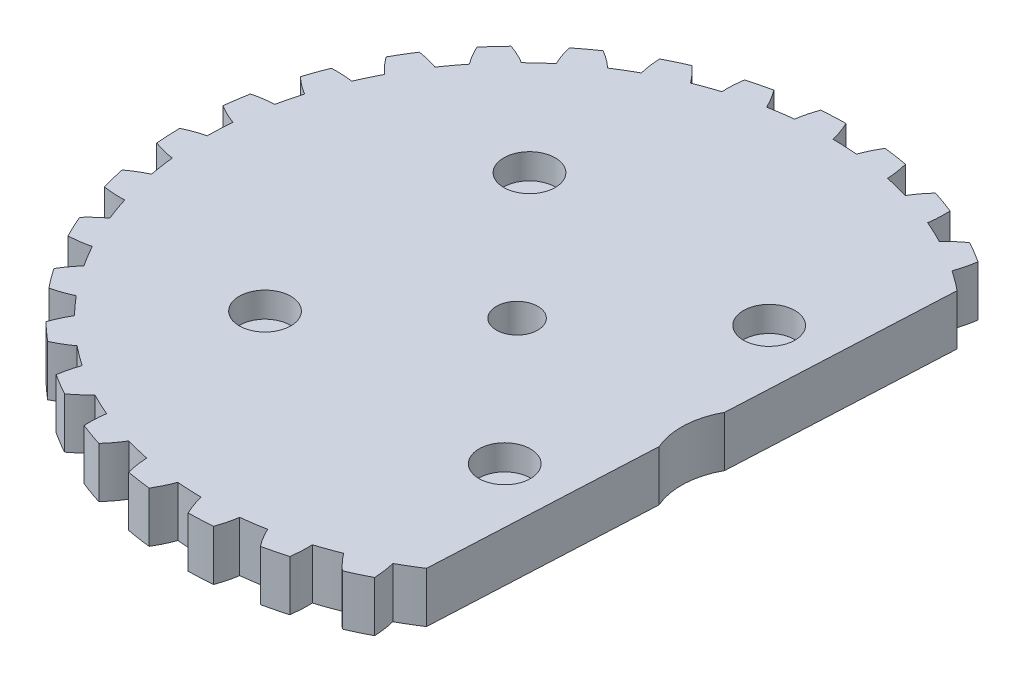
from build123d import *

# Parameters (mm, degrees)
SKETCH_5_R               = 62
EXTRUDE_5_DEPTH          = 10
EXTRUDE_6_DEPTH          = 10
PATTERN_CIRCULAR_3_COUNT = 32
SKETCH_6_R               = 5.1
CUT_EXTRUDE_1_DEPTH      = 5
SKETCH_7_R               = 4.1
CUT_EXTRUDE_2_DEPTH      = 94.864898271


with BuildPart() as part:
    # ｽｹｯﾁ5 → ﾎﾞｽ - 押し出し5 (new body)
    with BuildSketch(Plane(origin=(0, 0, 0), x_dir=(1, 0, 0), z_dir=(0, 1, 0))):
        with Locations(Location((0, 0, 0), (0, 0, 270))):
            Circle(SKETCH_5_R)
    extrude(amount=EXTRUDE_5_DEPTH)

    # ｽｹｯﾁ3 → ﾎﾞｽ - 押し出し6 (add)
    with BuildSketch(Plane(origin=(0, 0, 0), x_dir=(1, 0, 0), z_dir=(0, 1, 0))):
        with BuildLine():
            ThreePointArc((0.610421318, 61.996994974), (-3.042195808, 61.925318285), (-6.684250129, 61.638630746))
            add(Edge.make_bspline(
                [(-5.641686214, 65.758431981), (-5.705166523, 65.578395477), (-5.812149918, 65.264477653), (-5.954225381, 64.819801901), (-6.071216349, 64.43148887), (-6.177205967, 64.057284262), (-6.272697001, 63.69744192), (-6.358197404, 63.352203098), (-6.434220795, 63.02179612), (-6.501283354, 62.706436), (-6.559913319, 62.40632559), (-6.622924018, 62.052553392), (-6.662333587, 61.798155334), (-6.684250129, 61.638630746)],
                knots=[0, 0, 0, 0, 0.134543628, 0.233721196, 0.328992487, 0.420357503, 0.507816242, 0.591368706, 0.671014894, 0.746754806, 0.818588443, 0.886515803, 1, 1, 1, 1], degree=3))
            ThreePointArc((-5.641686214, 65.758431981), (-3.238466506, 65.92050011), (-0.830933502, 65.994769107))
            add(Edge.make_bspline(
                [(-0.830933502, 65.994769107), (-0.750112205, 65.821821686), (-0.612874637, 65.519901669), (-0.42789746, 65.091292982), (-0.273408504, 64.716316905), (-0.131250789, 64.354302994), (-0.000948853, 64.005553149), (0.117979164, 63.670357251), (0.226022029, 63.348992869), (0.323672361, 63.041724574), (0.411435971, 62.74880602), (0.508818995, 62.40291346), (0.572974167, 62.153603211), (0.610421318, 61.996994974)],
                knots=[0, 0, 0, 0, 0.134543628, 0.233721196, 0.328992487, 0.420357503, 0.507816242, 0.591368706, 0.671014894, 0.746754806, 0.818588443, 0.886515803, 1, 1, 1, 1], degree=3))
        make_face()
    extrude_6 = extrude(amount=EXTRUDE_6_DEPTH)

    # 円形ﾊﾟﾀｰﾝ3: ﾎﾞｽ - 押し出し6 ×32 about axis
    pattern_circular_3_axis = Axis((0, 10, 0), (0, 1, 0))
    for i in range(1, PATTERN_CIRCULAR_3_COUNT):
        add(extrude_6.rotate(pattern_circular_3_axis, i * 360 / PATTERN_CIRCULAR_3_COUNT))

    # ｽｹｯﾁ6 → ｶｯﾄ - 押し出し1 (cut)
    with BuildSketch(Plane(origin=(0, 10, 0), x_dir=(1, 0, 0), z_dir=(0, 1, 0))):
        with Locations(Location((-23.743194547, 26.196578263, 0), (0, 0, 270))):
            Circle(SKETCH_6_R)
        with Locations(Location((26.196578263, 23.743194547, 0), (0, 0, 90))):
            Circle(SKETCH_6_R)
        with Locations(Location((23.743194547, -26.196578263, 0), (0, 0, 270))):
            Circle(SKETCH_6_R)
        with Locations(Location((-26.196578263, -23.743194547, 0), (0, 0, 90))):
            Circle(SKETCH_6_R)
    extrude(amount=-CUT_EXTRUDE_1_DEPTH, mode=Mode.SUBTRACT)

    # ｽｹｯﾁ7 → ｶｯﾄ - 押し出し2 (cut, through all)
    with BuildSketch(Plane(origin=(0, 10, 0), x_dir=(1, 0, 0), z_dir=(0, 1, 0))):
        with Locations(Location((0, 0, 0), (0, 0, 270))):
            Circle(SKETCH_7_R)
        with BuildLine():
            Line((39.097451674, 53.173200699), (36.700955908, 4.391408717))
            ThreePointArc((36.700955908, 4.391408717), (34.957840967, -1.717368601), (36.09379745, -7.96758563))
            Line((36.09379745, -7.96758563), (33.697301683, -56.749377611))
            Line((33.697301683, -56.749377611), (63.220425114, -58.199755661))
            Line((63.220425114, -58.199755661), (68.620575105, 51.722822649))
            Line((68.620575105, 51.722822649), (39.097451674, 53.173200699))
        make_face()
    extrude(amount=-CUT_EXTRUDE_2_DEPTH, mode=Mode.SUBTRACT)


solid = part.part
